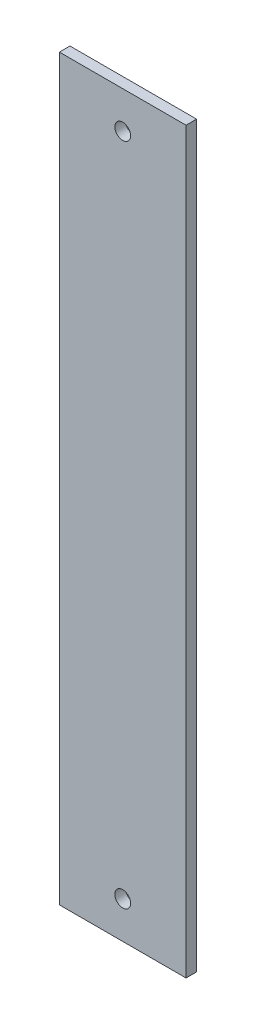
from build123d import *

# Parameters (mm, degrees)
SKETCH2_W           = 24
SKETCH2_H           = 140
SKETCH2_R           = 1.5
BOSS_EXTRUDE1_DEPTH = 2


with BuildPart() as part:
    # Sketch2 → Boss-Extrude1 (new body)
    with BuildSketch(Plane.XY):
        with Locations((12, 70)):
            Rectangle(SKETCH2_W, SKETCH2_H)
        with Locations((12, 133)):
            Circle(SKETCH2_R, mode=Mode.SUBTRACT)
        with Locations((12, 7)):
            Circle(SKETCH2_R, mode=Mode.SUBTRACT)
    extrude(amount=BOSS_EXTRUDE1_DEPTH)


solid = part.part
